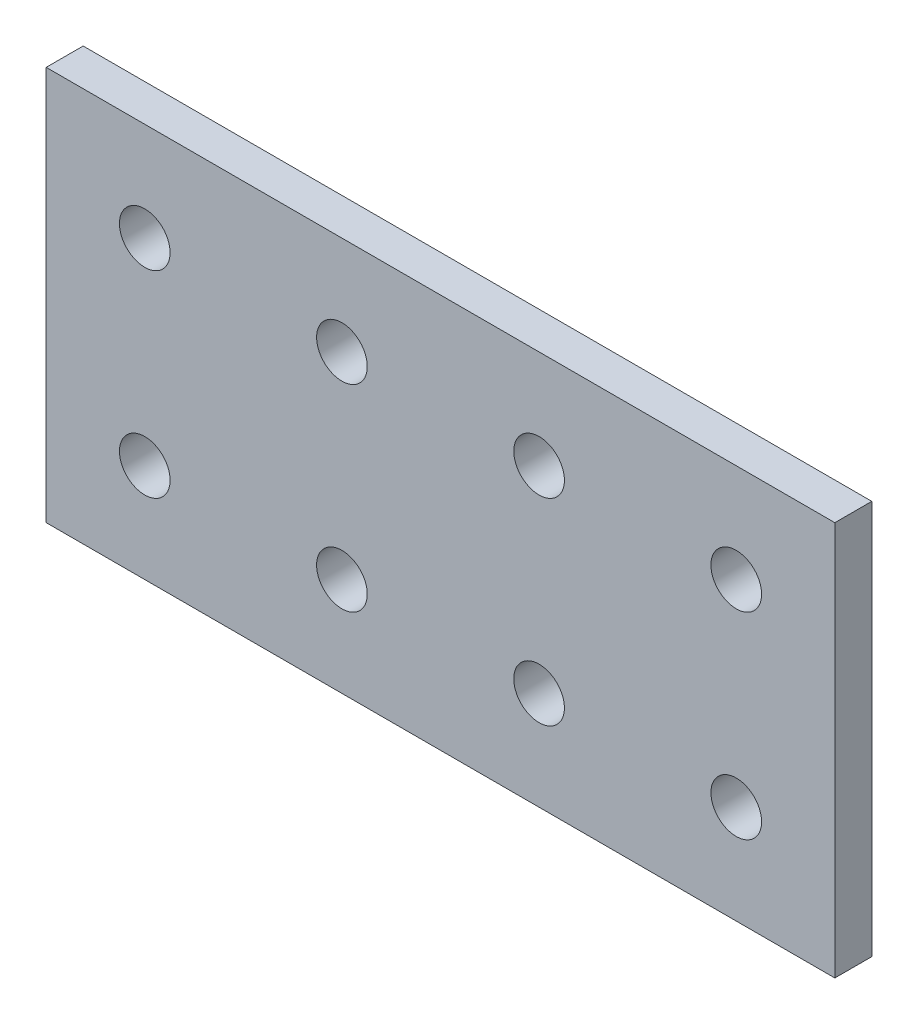
from build123d import *

# Parameters (mm, degrees)
SKETCH1_W           = 101.6
SKETCH1_H           = 50.8
SKETCH1_R           = 3.2639
BOSS_EXTRUDE1_DEPTH = 2.38125


with BuildPart() as part:
    # Sketch1 → Boss-Extrude1 (new, symmetric)
    with BuildSketch(Plane.XY):
        with Locations((50.8, 25.4)):
            Rectangle(SKETCH1_W, SKETCH1_H)
        with Locations(Location((12.7, 12.7, 0), (0, 0, 180))):
            Circle(SKETCH1_R, mode=Mode.SUBTRACT)
        with Locations(Location((38.1, 12.7, 0), (0, 0, 180))):
            Circle(SKETCH1_R, mode=Mode.SUBTRACT)
        with Locations(Location((63.5, 12.7, 0), (0, 0, 180))):
            Circle(SKETCH1_R, mode=Mode.SUBTRACT)
        with Locations(Location((88.9, 12.7, 0), (0, 0, 180))):
            Circle(SKETCH1_R, mode=Mode.SUBTRACT)
        with Locations(Location((12.7, 38.1, 0), (0, 0, 180))):
            Circle(SKETCH1_R, mode=Mode.SUBTRACT)
        with Locations(Location((38.1, 38.1, 0), (0, 0, 180))):
            Circle(SKETCH1_R, mode=Mode.SUBTRACT)
        with Locations(Location((63.5, 38.1, 0), (0, 0, 180))):
            Circle(SKETCH1_R, mode=Mode.SUBTRACT)
        with Locations(Location((88.9, 38.1, 0), (0, 0, 180))):
            Circle(SKETCH1_R, mode=Mode.SUBTRACT)
    extrude(amount=BOSS_EXTRUDE1_DEPTH, both=True)


solid = part.part
